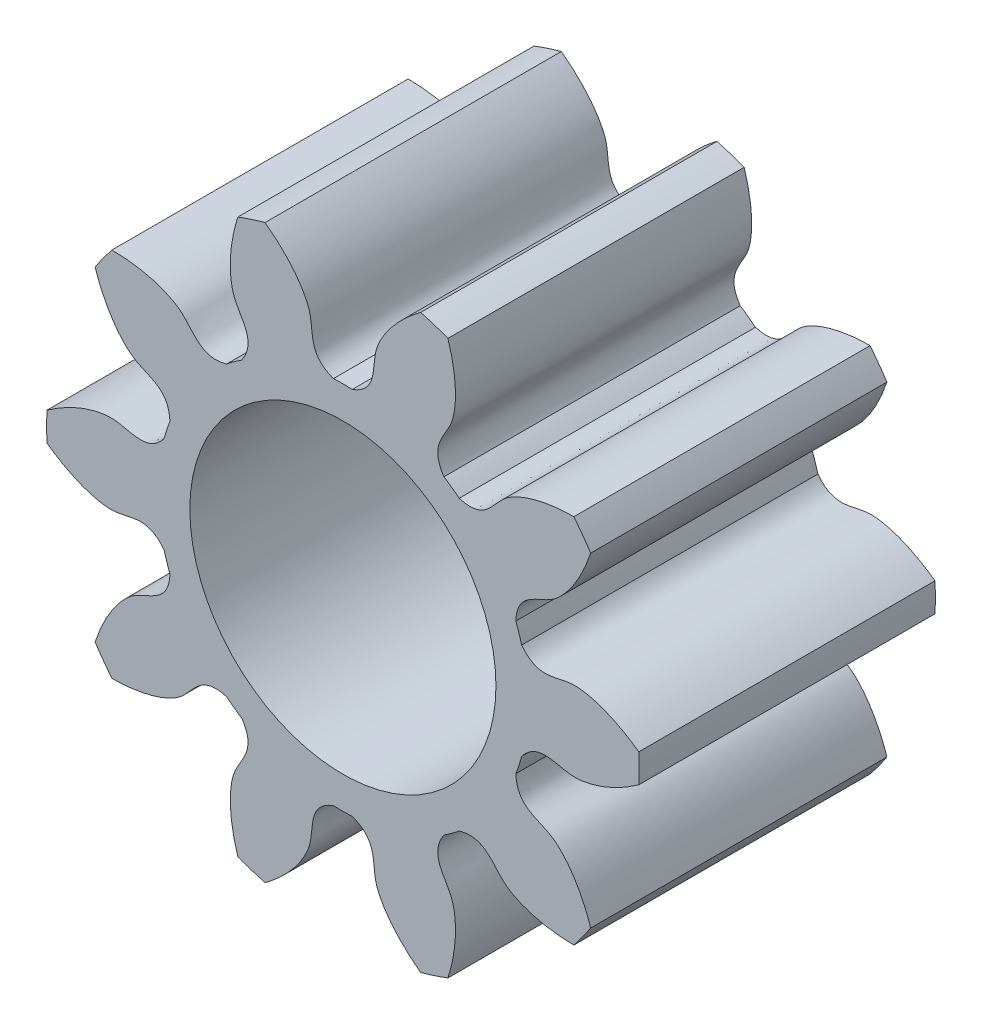
from build123d import *

# Parameters (mm, degrees)
SKETCH_1_R               = 3
EXTRUDE_1_DEPTH          = 3
CUT_EXTRUDE_1_DEPTH      = 6.196152423
PATTERN_CIRCULAR_1_COUNT = 10
CUT_EXTRUDE_2_REACH      = 7.136
SKETCH_4_R               = 1.55


with BuildPart() as part:
    # 草图1 → 凸台-拉伸1 (new body)
    with BuildSketch(Plane.XY):
        Circle(SKETCH_1_R)
    extrude(amount=EXTRUDE_1_DEPTH)

    # 草图2 → 切除-拉伸1 (cut, through all)
    with BuildSketch(Plane.XY):
        with BuildLine():
            ThreePointArc((0.095229133, 1.872580148), (0, 1.875), (-0.095229133, 1.872580148))
            add(Edge.make_bspline(
                [(-0.095229133, 1.872580148), (-0.362715165, 1.970284093), (-0.286920777, 2.185294723), (-0.344330803, 2.362336277), (-0.347251515, 2.37077245), (-0.350665635, 2.380030264), (-0.35460634, 2.390093167), (-0.359107284, 2.400943399), (-0.364201322, 2.412562246), (-0.369920867, 2.424929978), (-0.376297744, 2.438025881), (-0.383363205, 2.451828275), (-0.391147884, 2.466314521), (-0.399681784, 2.481461042), (-0.408994243, 2.497243338), (-0.419113912, 2.513636003), (-0.430068732, 2.530612743), (-0.441885908, 2.548146397), (-0.454591887, 2.566208951), (-0.468212335, 2.58477156), (-0.482772111, 2.603804571), (-0.498295251, 2.623277538), (-0.514804941, 2.64315925), (-0.532323498, 2.663417745), (-0.550872351, 2.68402034), (-0.570472019, 2.704933651), (-0.591142092, 2.726123613), (-0.612901212, 2.747555509), (-0.635767055, 2.769193992), (-0.659756316, 2.79100311), (-0.684884687, 2.812946332), (-0.711166843, 2.834986573), (-0.73861643, 2.857086218), (-0.767246042, 2.879207155), (-0.797067213, 2.901310796), (-0.828090401, 2.923358104), (-0.860324974, 2.945309627), (-0.8937792, 2.967125519), (-0.928460232, 2.988765572), (-0.964374099, 3.010189244), (-1.001525696, 3.031355689), (-1.039918773, 3.052223783), (-1.079555927, 3.072752157), (-1.120438592, 3.092899225), (-1.162567035, 3.112623216), (-1.205940346, 3.131882201), (-1.250556433, 3.150634125), (-1.296412017, 3.168836838), (-1.343502628, 3.186448125), (-1.3918226, 3.203425737), (-1.441365068, 3.219727424), (-1.492121969, 3.235310961), (-1.544084033, 3.250134185), (-1.597240793, 3.264155023), (-1.651580574, 3.277331523), (-1.707090504, 3.289621887), (-1.763756505, 3.300984501), (-1.821563307, 3.311377967), (-1.880494441, 3.320761135), (-1.940532246, 3.329093134), (-2.022655253, 3.338820511), (-2.084917451, 3.344293469), (-2.126793313, 3.34714445)],
                knots=[0, 0, 0, 0, 0.201720712, 0.204696754, 0.208022917, 0.211699204, 0.215725612, 0.220102144, 0.224828797, 0.229905574, 0.235332472, 0.241109493, 0.247236637, 0.253713903, 0.260541292, 0.267718803, 0.275246437, 0.283124193, 0.291352071, 0.299930073, 0.308858196, 0.318136442, 0.327764811, 0.337743302, 0.348071916, 0.358750652, 0.36977951, 0.381158491, 0.392887595, 0.404966821, 0.41739617, 0.430175641, 0.443305234, 0.45678495, 0.470614789, 0.48479475, 0.499324833, 0.514205039, 0.529435368, 0.545015819, 0.560946392, 0.577227088, 0.593857907, 0.610838848, 0.628169911, 0.645851097, 0.663882406, 0.682263837, 0.70099539, 0.720077066, 0.739508864, 0.759290785, 0.779422829, 0.799904995, 0.820737283, 0.841919694, 0.863452227, 0.885334883, 0.907567662, 0.930150562, 0.953083586, 1, 1, 1, 1], degree=3))
            ThreePointArc((-2.126793313, 3.34714445), (0, 3.965680996), (2.126793313, 3.34714445))
            add(Edge.make_bspline(
                [(0.095229133, 1.872580148), (0.362715165, 1.970284093), (0.286920777, 2.185294723), (0.344330803, 2.362336277), (0.347251515, 2.37077245), (0.350665635, 2.380030264), (0.35460634, 2.390093167), (0.359107284, 2.400943399), (0.364201322, 2.412562246), (0.369920867, 2.424929978), (0.376297744, 2.438025881), (0.383363205, 2.451828275), (0.391147884, 2.466314521), (0.399681784, 2.481461042), (0.408994243, 2.497243338), (0.419113912, 2.513636003), (0.430068732, 2.530612743), (0.441885908, 2.548146397), (0.454591887, 2.566208951), (0.468212335, 2.58477156), (0.482772111, 2.603804571), (0.498295251, 2.623277538), (0.514804941, 2.64315925), (0.532323498, 2.663417745), (0.550872351, 2.68402034), (0.570472019, 2.704933651), (0.591142092, 2.726123613), (0.612901212, 2.747555509), (0.635767055, 2.769193992), (0.659756316, 2.79100311), (0.684884687, 2.812946332), (0.711166843, 2.834986573), (0.73861643, 2.857086218), (0.767246042, 2.879207155), (0.797067213, 2.901310796), (0.828090401, 2.923358104), (0.860324974, 2.945309627), (0.8937792, 2.967125519), (0.928460232, 2.988765572), (0.964374099, 3.010189244), (1.001525696, 3.031355689), (1.039918773, 3.052223783), (1.079555927, 3.072752157), (1.120438592, 3.092899225), (1.162567035, 3.112623216), (1.205940346, 3.131882201), (1.250556433, 3.150634125), (1.296412017, 3.168836838), (1.343502628, 3.186448125), (1.3918226, 3.203425737), (1.441365068, 3.219727424), (1.492121969, 3.235310961), (1.544084033, 3.250134185), (1.597240793, 3.264155023), (1.651580574, 3.277331523), (1.707090504, 3.289621887), (1.763756505, 3.300984501), (1.821563307, 3.311377967), (1.880494441, 3.320761135), (1.940532246, 3.329093134), (2.022655253, 3.338820511), (2.084917451, 3.344293469), (2.126793313, 3.34714445)],
                knots=[0, 0, 0, 0, 0.201720712, 0.204696754, 0.208022917, 0.211699204, 0.215725612, 0.220102144, 0.224828797, 0.229905574, 0.235332472, 0.241109493, 0.247236637, 0.253713903, 0.260541292, 0.267718803, 0.275246437, 0.283124193, 0.291352071, 0.299930073, 0.308858196, 0.318136442, 0.327764811, 0.337743302, 0.348071916, 0.358750652, 0.36977951, 0.381158491, 0.392887595, 0.404966821, 0.41739617, 0.430175641, 0.443305234, 0.45678495, 0.470614789, 0.48479475, 0.499324833, 0.514205039, 0.529435368, 0.545015819, 0.560946392, 0.577227088, 0.593857907, 0.610838848, 0.628169911, 0.645851097, 0.663882406, 0.682263837, 0.70099539, 0.720077066, 0.739508864, 0.759290785, 0.779422829, 0.799904995, 0.820737283, 0.841919694, 0.863452227, 0.885334883, 0.907567662, 0.930150562, 0.953083586, 1, 1, 1, 1], degree=3))
        make_face()
    cut_extrude_1 = extrude(amount=CUT_EXTRUDE_1_DEPTH, mode=Mode.SUBTRACT)

    # 阵列(圆周)1: 切除-拉伸1 ×10 about axis
    pattern_circular_1_axis = Axis((0, 0, -0.3), (0, 0, 1))
    for i in range(1, PATTERN_CIRCULAR_1_COUNT):
        add(cut_extrude_1.rotate(pattern_circular_1_axis, i * 360 / PATTERN_CIRCULAR_1_COUNT), mode=Mode.SUBTRACT)

    # 草图4 → 切除-拉伸2 (cut, up to next)
    with BuildSketch(Plane(origin=(0, 0, 0), x_dir=(-1, 0, 0), z_dir=(0, 0, -1)), mode=Mode.PRIVATE) as cut_extrude_2_sk1:
        Circle(SKETCH_4_R)
    cut_extrude_2_tool1 = extrude(cut_extrude_2_sk1.sketch, amount=-CUT_EXTRUDE_2_REACH, mode=Mode.PRIVATE) & part.part
    add(cut_extrude_2_tool1.solids().sort_by_distance((0, 0, 0))[0], mode=Mode.SUBTRACT)


solid = part.part
